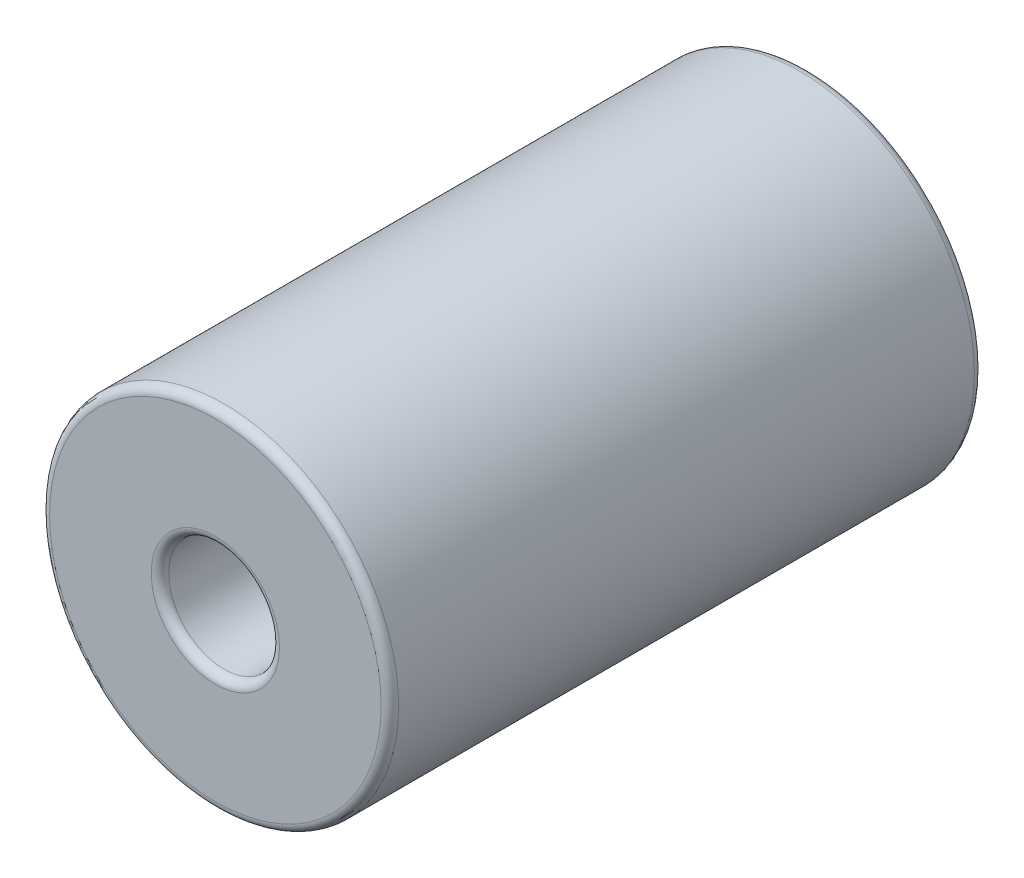
from build123d import *

# Parameters (mm, degrees)
SKETCH_1_R          = 10
EXTRUDE_1_DEPTH     = 34
SKETCH_2_R          = 3.175
CUT_EXTRUDE_1_DEPTH = 11
SKETCH_3_R          = 4
CUT_EXTRUDE_2_DEPTH = 11
FILLET_1_R          = 0.5
FILLET_2_R          = 0.5
FILLET_3_R          = 0.5


with BuildPart() as part:
    # Эскиз1 → Бобышка-Вытянуть1 (new body)
    with BuildSketch(Plane.XY):
        Circle(SKETCH_1_R)
    extrude(amount=EXTRUDE_1_DEPTH)

    # Эскиз2 → Вырез-Вытянуть1 (cut)
    with BuildSketch(Plane.XY.offset(34)):
        Circle(SKETCH_2_R)
    extrude(amount=-CUT_EXTRUDE_1_DEPTH, mode=Mode.SUBTRACT)

    # Эскиз3 → Вырез-Вытянуть2 (cut)
    with BuildSketch(Plane(origin=(0, 0, 0), x_dir=(-1, 0, 0), z_dir=(0, 0, -1))):
        Circle(SKETCH_3_R)
    extrude(amount=-CUT_EXTRUDE_2_DEPTH, mode=Mode.SUBTRACT)

    # Скругление1
    fillet_1_edges = [part.edges().sort_by_distance(p)[0] for p in [
        (-10, 0, 0),
        (-10, 0, 34),
    ]]
    fillet(fillet_1_edges, radius=FILLET_1_R)

    # Скругление2
    fillet_2_edges = [part.edges().sort_by_distance(p)[0] for p in [
        (4, 0, 0),
        (-3.175, 0, 34),
    ]]
    fillet(fillet_2_edges, radius=FILLET_2_R)

    # Скругление3
    fillet_3_edges = [part.edges().sort_by_distance(p)[0] for p in [
        (4, 0, 11),
        (-3.175, 0, 23),
    ]]
    fillet(fillet_3_edges, radius=FILLET_3_R)


solid = part.part
